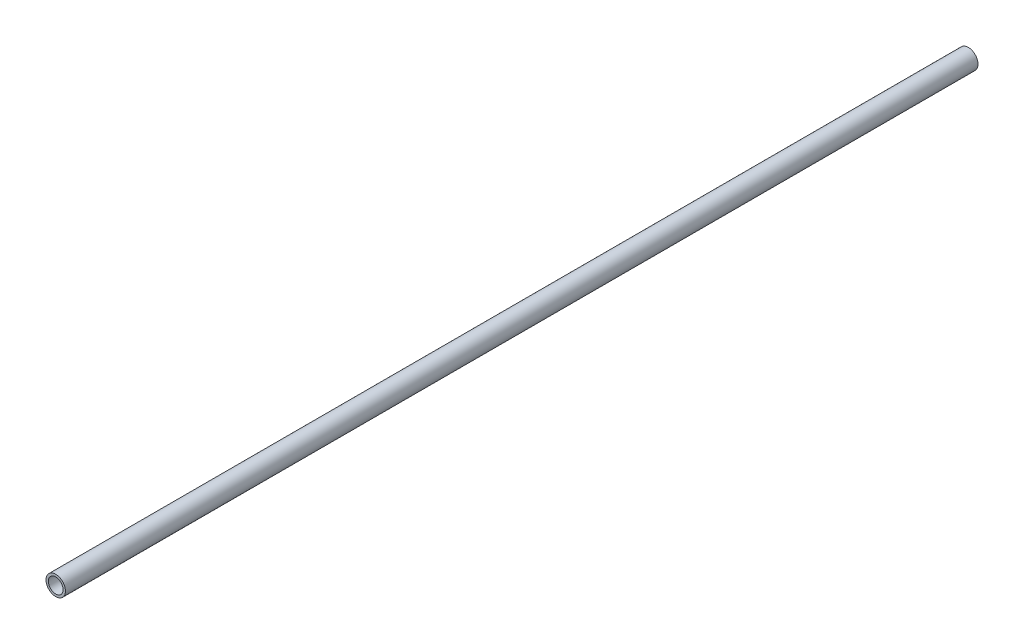
from build123d import *

# Parameters (mm, degrees)
SKETCH1_R           = 16.7005
SKETCH1_R_2         = 12.7
BOSS_EXTRUDE1_DEPTH = 1568.196


with BuildPart() as part:
    # Sketch1 → Boss-Extrude1 (new body)
    with BuildSketch(Plane.XY):
        with Locations(Location((0, 0, 0), (0, 0, 180))):
            Circle(SKETCH1_R)
        with Locations(Location((0, 0, 0), (0, 0, 180))):
            Circle(SKETCH1_R_2, mode=Mode.SUBTRACT)
    extrude(amount=BOSS_EXTRUDE1_DEPTH)


solid = part.part
